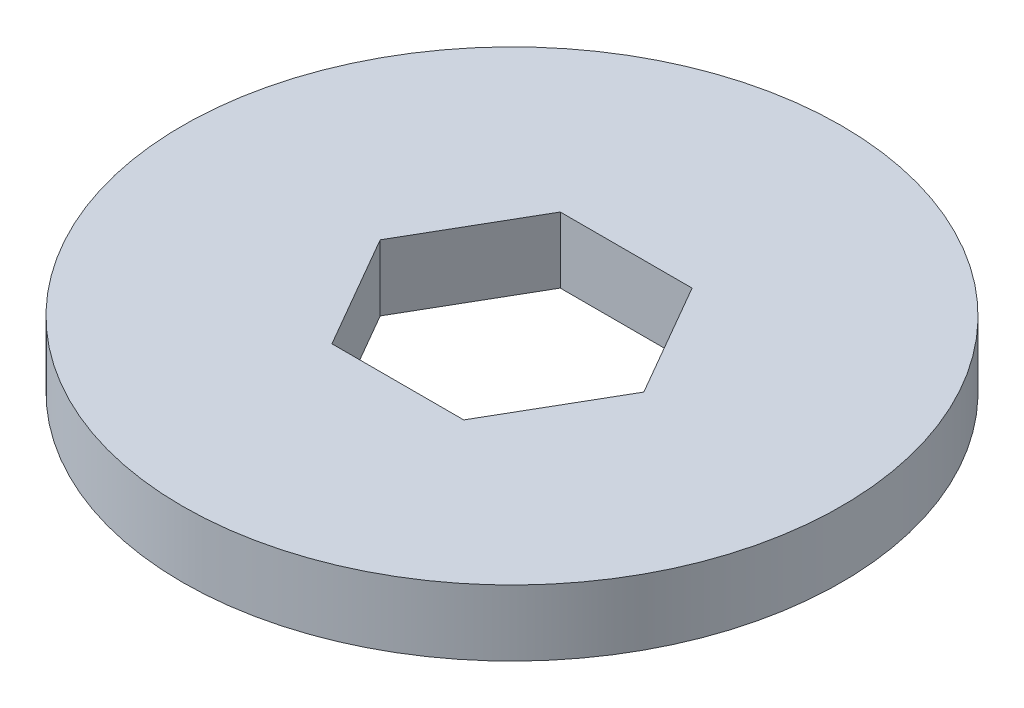
from build123d import *

# Parameters (mm, degrees)
SKETCH1_R           = 10
BOSS_EXTRUDE1_DEPTH = 2


with BuildPart() as part:
    # Sketch1 → Boss-Extrude1 (new body)
    with BuildSketch(Plane(origin=(0, 0, 0), x_dir=(1, 0, 0), z_dir=(0, 1, 0))):
        with Locations(Location((0, 0, 0), (0, 0, 270))):
            Circle(SKETCH1_R)
        Polygon((4, 0), (2, 3.464101615), (-2, 3.464101615), (-4, 0), (-2, -3.464101615), (2, -3.464101615), align=None, mode=Mode.SUBTRACT)
    extrude(amount=BOSS_EXTRUDE1_DEPTH)


solid = part.part
